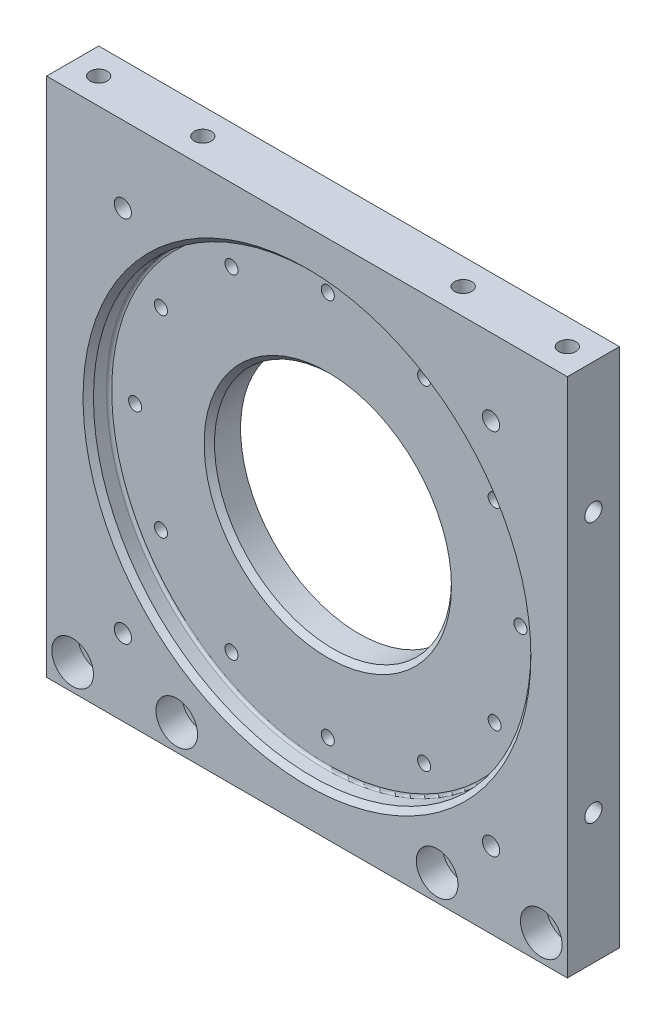
from build123d import *

# Parameters (mm, degrees)
SKETCH1_W                                           = 10
SKETCH1_H                                           = 100
BOSS_EXTRUDE1_DEPTH                                 = 50
SKETCH2_R                                           = 42
CUT_EXTRUDE1_DEPTH                                  = 4
CUT_EXTRUDE3_REACH                                  = 72.965
SKETCH4_R                                           = 22.75
M3_TAPPED_HOLE1_D                                   = 2.5
FILLET3_R                                           = 0.5
CHAMFER1_SIZE                                       = 1
CBORE_FOR_M4_HEX_SOCKET_HEAD_CAP_SCREW1_D           = 4.5
CBORE_FOR_M4_HEX_SOCKET_HEAD_CAP_SCREW1_CBORE_D     = 8
CBORE_FOR_M4_HEX_SOCKET_HEAD_CAP_SCREW1_CBORE_DEPTH = 5
M4_TAPPED_HOLE1_D                                   = 3.3
M4_TAPPED_HOLE1_DEPTH                               = 11
M4_TAPPED_HOLE1_TIP                                 = 0.991420021
M4_TAPPED_HOLE2_D                                   = 3.3
M4_TAPPED_HOLE2_DEPTH                               = 11
M4_TAPPED_HOLE2_TIP                                 = 0.991420021
M4_TAPPED_HOLE3_D                                   = 3.3
M4_TAPPED_HOLE3_DEPTH                               = 11
M4_TAPPED_HOLE3_TIP                                 = 0.991420021
M4_TAPPED_HOLE4_D                                   = 3.3


with BuildPart() as part:
    # Sketch1 → Boss-Extrude1 (new, symmetric)
    with BuildSketch(Plane(origin=(0, 0, 0), x_dir=(0, 0, -1), z_dir=(1, 0, 0))):
        Rectangle(SKETCH1_W, SKETCH1_H)
    extrude(amount=BOSS_EXTRUDE1_DEPTH, both=True)

    # Sketch2 → Cut-Extrude1 (cut)
    with BuildSketch(Plane.XY.offset(5)):
        Circle(SKETCH2_R)
    extrude(amount=-CUT_EXTRUDE1_DEPTH, mode=Mode.SUBTRACT)

    # Sketch4 → Cut-Extrude3 (cut, up to next)
    with BuildSketch(Plane.XY.offset(1), mode=Mode.PRIVATE) as cut_extrude3_sk1:
        Circle(SKETCH4_R)
    cut_extrude3_tool1 = extrude(cut_extrude3_sk1.sketch, amount=-CUT_EXTRUDE3_REACH, mode=Mode.PRIVATE) & part.part
    add(cut_extrude3_tool1.solids().sort_by_distance((0, 0, 1))[0], mode=Mode.SUBTRACT)

    # M3 Tapped Hole1 (through all)
    with Locations(Plane.XY.offset(1)):
        with Locations((-32.04293994, -18.5), (-37, 0), (37, 0), (18.5, 32.04293994), (-32.04293994, 18.5), (32.04293994, -18.5), (-18.5, -32.04293994), (0, 37), (0, -37), (-18.5, 32.04293994), (18.5, -32.04293994), (32.04293994, 18.5)):
            Hole(M3_TAPPED_HOLE1_D / 2)

    # Fillet3
    fillet3_edges = [part.edges().sort_by_distance(p)[0] for p in [
        (-42, 0, 1),
    ]]
    fillet(fillet3_edges, radius=FILLET3_R)

    # Chamfer1
    chamfer1_edges = [part.edges().sort_by_distance(p)[0] for p in [
        (-42, 0, 5),
        (-22.75, 0, 1),
    ]]
    chamfer(chamfer1_edges, length=CHAMFER1_SIZE)

    # CBORE for M4 Hex Socket Head Cap Screw1 (through all)
    with Locations(Plane.XY.offset(5)):
        with Locations((-45, -45), (-25, -45), (25, -45), (45, -45)):
            CounterBoreHole(CBORE_FOR_M4_HEX_SOCKET_HEAD_CAP_SCREW1_D / 2, CBORE_FOR_M4_HEX_SOCKET_HEAD_CAP_SCREW1_CBORE_D / 2, CBORE_FOR_M4_HEX_SOCKET_HEAD_CAP_SCREW1_CBORE_DEPTH)

    # M4 Tapped Hole1
    with Locations(Plane(origin=(0, 50, 0), x_dir=(1, 0, 0), z_dir=(0, 1, 0))):
        with Locations((-45, 0), (-25, 0), (25, 0), (45, 0)):
            Hole(M4_TAPPED_HOLE1_D / 2, depth=M4_TAPPED_HOLE1_DEPTH)
            with Locations((0, 0, -(M4_TAPPED_HOLE1_DEPTH + M4_TAPPED_HOLE1_TIP / 2))):  # 118° drill point
                Cone(0, M4_TAPPED_HOLE1_D / 2, M4_TAPPED_HOLE1_TIP, mode=Mode.SUBTRACT)

    # M4 Tapped Hole2
    with Locations(Plane(origin=(50, 0, 0), x_dir=(0, 0, -1), z_dir=(1, 0, 0))):
        with Locations((0, 25), (0, -25)):
            Hole(M4_TAPPED_HOLE2_D / 2, depth=M4_TAPPED_HOLE2_DEPTH)
            with Locations((0, 0, -(M4_TAPPED_HOLE2_DEPTH + M4_TAPPED_HOLE2_TIP / 2))):  # 118° drill point
                Cone(0, M4_TAPPED_HOLE2_D / 2, M4_TAPPED_HOLE2_TIP, mode=Mode.SUBTRACT)

    # M4 Tapped Hole3
    with Locations(Plane.ZY.offset(50)):
        with Locations((0, 25), (0, -25)):
            Hole(M4_TAPPED_HOLE3_D / 2, depth=M4_TAPPED_HOLE3_DEPTH)
            with Locations((0, 0, -(M4_TAPPED_HOLE3_DEPTH + M4_TAPPED_HOLE3_TIP / 2))):  # 118° drill point
                Cone(0, M4_TAPPED_HOLE3_D / 2, M4_TAPPED_HOLE3_TIP, mode=Mode.SUBTRACT)

    # M4 Tapped Hole4 (through all)
    with Locations(Plane.XY.offset(5)):
        with Locations((35.355339059, -35.355339059), (35.355339059, 35.355339059), (-35.355339059, 35.355339059), (-35.355339059, -35.355339059)):
            Hole(M4_TAPPED_HOLE4_D / 2)


solid = part.part
